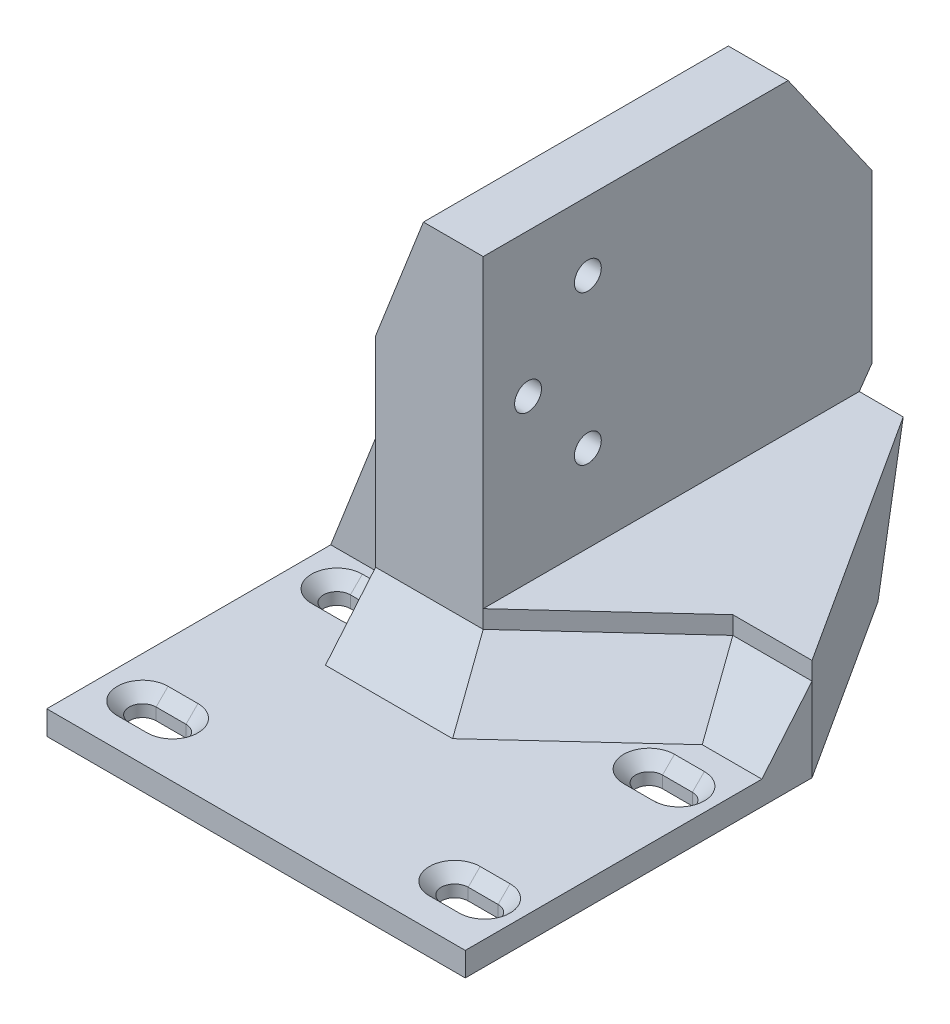
from build123d import *
from OCP.BRepFilletAPI import BRepFilletAPI_MakeChamfer

# Parameters (mm, degrees)
BOSS_EXTRUDE1_DEPTH        = 4
BOSS_EXTRUDE2_DEPTH        = 64
SKETCH3_W                  = 35
SKETCH3_H                  = 51
CUT_EXTRUDE1_DEPTH         = 101.369318021
CUT_EXTRUDE2_DEPTH         = 123.474487139
CHAMFER1_SIZE              = 10
CHAMFER1_SIZE2             = 8.390996312
F_4_5_4_5_DIAMETER_HOLE1_D = 4.5
CUT_EXTRUDE3_DEPTH         = 109.166538264
CUT_EXTRUDE4_DEPTH         = 111.113577728
CUT_EXTRUDE5_DEPTH         = 10
CHAMFER3_SIZE              = 2


with BuildPart() as part:
    # Sketch1 → Boss-Extrude1 (new body)
    with BuildSketch(Plane(origin=(0, 0, 0), x_dir=(1, 0, 0), z_dir=(0, 1, 0))):
        Polygon((-35, 29), (0, 74), (6, 74), (35, 29), (35, -29), (-35, -29), align=None)
    extrude(amount=BOSS_EXTRUDE1_DEPTH)

    # Sketch2 → Boss-Extrude2 (add)
    with BuildSketch(Plane(origin=(0, 4, 0), x_dir=(1, 0, 0), z_dir=(0, 1, 0))):
        Polygon((35, 29), (21.75, 29), (0, 9), (-18, 9), (-18, 18.5), (-35, 18.5), (-35, 29), (0, 74), (6, 74), align=None)
    extrude(amount=BOSS_EXTRUDE2_DEPTH)

    # Sketch3 → Cut-Extrude1 (cut, through all)
    with BuildSketch(Plane.XY.offset(-9)):
        Polygon((-35, 4), (-10, 68), (-35, 68), align=None)
        with Locations((17.5, 42.5)):
            Rectangle(SKETCH3_W, SKETCH3_H)
    extrude(amount=-CUT_EXTRUDE1_DEPTH, mode=Mode.SUBTRACT)

    # Sketch4 → Cut-Extrude2 (cut, through all)
    with BuildSketch(Plane(origin=(35, 0, 0), x_dir=(0, 0, -1), z_dir=(1, 0, 0))):
        Polygon((60, 0), (74, 20), (74, 0), align=None)
        Polygon((60, 68), (74, 68), (74, 48), align=None)
    extrude(amount=-CUT_EXTRUDE2_DEPTH, mode=Mode.SUBTRACT)

    # Chamfer1: one chamfer whose edges measure the first distance from different faces: ONE call of the kernel's chamfer builder (chamfer() names one face for all edges)
    chamfer1_edges_1 = [part.edges().sort_by_distance(p)[0] for p in [
        (-9, 4, -9),
    ]]
    chamfer1_side_1 = [part.faces().sort_by_distance(p)[0] for p in [
        (-8.515151515, 34.072854864, -9),
    ]]
    chamfer1_edges_2 = [part.edges().sort_by_distance(p)[0] for p in [
        (10.875, 4, -19),
    ]]
    chamfer1_side_2 = [part.faces().sort_by_distance(p)[0] for p in [
        (10.875, 10.5, -19),
    ]]
    chamfer1_edges_3 = [part.edges().sort_by_distance(p)[0] for p in [
        (28.375, 4, -29),
    ]]
    chamfer1_side_3 = [part.faces().sort_by_distance(p)[0] for p in [
        (28.375, 10.5, -29),
    ]]
    chamfer1 = BRepFilletAPI_MakeChamfer(part.part.solid().wrapped)
    for e in chamfer1_edges_1:
        chamfer1.Add(CHAMFER1_SIZE, CHAMFER1_SIZE2, e.wrapped, chamfer1_side_1[0].wrapped)  # the first distance lies on this face
    for e in chamfer1_edges_2:
        chamfer1.Add(CHAMFER1_SIZE, CHAMFER1_SIZE2, e.wrapped, chamfer1_side_2[0].wrapped)  # the first distance lies on this face
    for e in chamfer1_edges_3:
        chamfer1.Add(CHAMFER1_SIZE, CHAMFER1_SIZE2, e.wrapped, chamfer1_side_3[0].wrapped)  # the first distance lies on this face
    add(Compound.cast(chamfer1.Shape()), mode=Mode.REPLACE)

    # Ø4.5 (4.5) Diameter Hole1 (through all)
    with Locations(Plane(origin=(0, 0, 0), x_dir=(0, 0, -1), z_dir=(1, 0, 0))):
        with Locations((16.5, 44), (26.5, 31.5), (26.5, 56.5)):
            Hole(F_4_5_4_5_DIAMETER_HOLE1_D / 2)

    # Sketch9 → Cut-Extrude3 (cut, through all)
    with BuildSketch(Plane(origin=(-5, 0, 0), x_dir=(0, 0, -1), z_dir=(1, 0, 0))):
        Polygon((29.964101615, 56.5), (28.232050808, 59.5), (24.767949192, 59.5), (23.035898385, 56.5), (24.767949192, 53.5), (28.232050808, 53.5), align=None)
        Polygon((29.964101615, 31.5), (28.232050808, 34.5), (24.767949192, 34.5), (23.035898385, 31.5), (24.767949192, 28.5), (28.232050808, 28.5), align=None)
        Polygon((19.964101615, 44), (18.232050808, 47), (14.767949192, 47), (13.035898385, 44), (14.767949192, 41), (18.232050808, 41), align=None)
    extrude(amount=-CUT_EXTRUDE3_DEPTH, mode=Mode.SUBTRACT)

    # Sketch10 → Cut-Extrude4 (cut, through all)
    with BuildSketch(Plane(origin=(-10, 0, 0), x_dir=(0, 0, -1), z_dir=(1, 0, 0))):
        Polygon((30.887862046, 56.5), (28.693931023, 60.3), (24.306068977, 60.3), (22.112137954, 56.5), (24.306068977, 52.7), (28.693931023, 52.7), align=None)
        Polygon((20.887862046, 44), (18.693931023, 47.8), (14.306068977, 47.8), (12.112137954, 44), (14.306068977, 40.2), (18.693931023, 40.2), align=None)
        Polygon((30.887862046, 31.5), (28.693931023, 35.3), (24.306068977, 35.3), (22.112137954, 31.5), (24.306068977, 27.7), (28.693931023, 27.7), align=None)
    extrude(amount=-CUT_EXTRUDE4_DEPTH, mode=Mode.SUBTRACT)

    # Sketch11 → Cut-Extrude5 (cut)
    with BuildSketch(Plane(origin=(0, 4, 0), x_dir=(1, 0, 0), z_dir=(0, 1, 0))):
        with BuildLine():
            Line((-28.11, -17.6), (-23.11, -17.6))
            ThreePointArc((-23.11, -17.6), (-20.86, -19.85), (-23.11, -22.1))
            Line((-23.11, -22.1), (-28.11, -22.1))
            ThreePointArc((-28.11, -22.1), (-30.36, -19.85), (-28.11, -17.6))
        make_face()
        with BuildLine():
            Line((24.09, -17.6), (29.09, -17.6))
            ThreePointArc((29.09, -17.6), (31.34, -19.85), (29.09, -22.1))
            Line((29.09, -22.1), (24.09, -22.1))
            ThreePointArc((24.09, -22.1), (21.84, -19.85), (24.09, -17.6))
        make_face()
        with BuildLine():
            Line((-28.11, 14.9), (-23.11, 14.9))
            ThreePointArc((-23.11, 14.9), (-20.86, 12.65), (-23.11, 10.4))
            Line((-23.11, 10.4), (-28.11, 10.4))
            ThreePointArc((-28.11, 10.4), (-30.36, 12.65), (-28.11, 14.9))
        make_face()
        with BuildLine():
            Line((24.09, 14.9), (29.09, 14.9))
            ThreePointArc((29.09, 14.9), (31.34, 12.65), (29.09, 10.4))
            Line((29.09, 10.4), (24.09, 10.4))
            ThreePointArc((24.09, 10.4), (21.84, 12.65), (24.09, 14.9))
        make_face()
    extrude(amount=-CUT_EXTRUDE5_DEPTH, mode=Mode.SUBTRACT)

    # Chamfer3
    chamfer3_edges = [part.edges().sort_by_distance(p)[0] for p in [
        (21.84, 4, 19.85),
        (26.59, 4, 22.1),
        (31.34, 4, 19.85),
        (26.59, 4, 17.6),
        (-30.36, 4, -12.65),
        (-25.61, 4, -10.4),
        (-20.86, 4, -12.65),
        (-25.61, 4, -14.9),
        (21.84, 4, -12.65),
        (26.59, 4, -10.4),
        (31.34, 4, -12.65),
        (26.59, 4, -14.9),
        (-30.36, 4, 19.85),
        (-25.61, 4, 22.1),
        (-20.86, 4, 19.85),
        (-25.61, 4, 17.6),
    ]]
    chamfer(chamfer3_edges, length=CHAMFER3_SIZE)


solid = part.part
